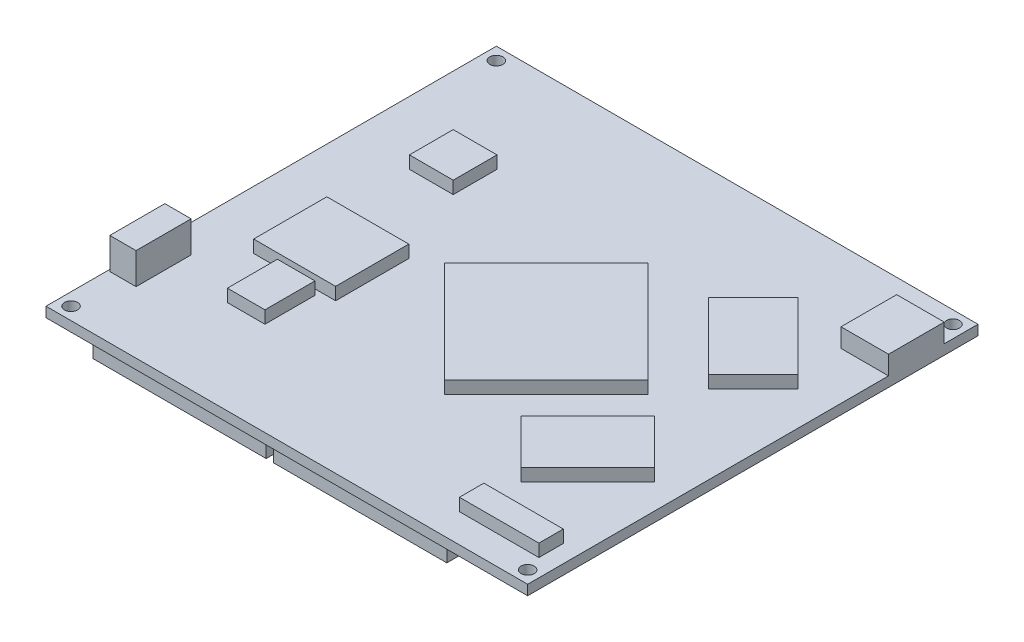
from build123d import *

# Parameters (mm, degrees)
SKETCH_1_W      = 77
SKETCH_1_H      = 72
SKETCH_1_R      = 1.05
EXTRUDE_1_DEPTH = 1.6
SKETCH_2_W      = 7
SKETCH_2_H      = 7
SKETCH_2_W_2    = 13.1
SKETCH_2_H_2    = 11.7
SKETCH_2_W_3    = 6
SKETCH_2_H_3    = 8
SKETCH_2_W_4    = 12.7
SKETCH_2_H_4    = 3.9
EXTRUDE_2_DEPTH = 2
SKETCH_3_W      = 7.6
SKETCH_3_H      = 8.9
EXTRUDE_3_DEPTH = 3
SKETCH_5_W      = 4.2
SKETCH_5_H      = 8.8
EXTRUDE_4_DEPTH = 5
SKETCH_6_W      = 27.7
SKETCH_6_H      = 3.9
EXTRUDE_5_DEPTH = 5


with BuildPart() as part:
    # 草图1 → 凸台-拉伸1 (new body)
    with BuildSketch(Plane(origin=(0, 0, 0), x_dir=(1, 0, 0), z_dir=(0, 1, 0))):
        with Locations((38.5, -36)):
            Rectangle(SKETCH_1_W, SKETCH_1_H)
        with Locations(Location((2, -2, 0), (0, 0, 270))):
            Circle(SKETCH_1_R, mode=Mode.SUBTRACT)
        with Locations(Location((2, -70, 0), (0, 0, 270))):
            Circle(SKETCH_1_R, mode=Mode.SUBTRACT)
        with Locations(Location((75, -2, 0), (0, 0, 270))):
            Circle(SKETCH_1_R, mode=Mode.SUBTRACT)
        with Locations(Location((75, -70, 0), (0, 0, 270))):
            Circle(SKETCH_1_R, mode=Mode.SUBTRACT)
    extrude(amount=EXTRUDE_1_DEPTH)

    # 草图2 → 凸台-拉伸2 (add)
    with BuildSketch(Plane(origin=(0, 1.6, 0), x_dir=(1, 0, 0), z_dir=(0, 1, 0))):
        with Locations((13.6, -20.5)):
            Rectangle(SKETCH_2_W, SKETCH_2_H)
        Polygon((44.1, -19.873088065), (27.836544033, -36.136544033), (44.1, -52.4), (60.363455967, -36.136544033), align=None)
        with Locations((15.85, -42.25)):
            Rectangle(SKETCH_2_W_2, SKETCH_2_H_2)
        with Locations((17, -53)):
            Rectangle(SKETCH_2_W_3, SKETCH_2_H_3)
        Polygon((65.835533906, -40.580909114), (55.15822151, -51.25822151), (62.3, -58.4), (72.977312396, -47.722687604), align=None)
        Polygon((60.864466094, -12.680909114), (53.722687604, -19.822687604), (64.4, -30.5), (71.54177849, -23.35822151), align=None)
        with Locations((67.85, -65.45)):
            Rectangle(SKETCH_2_W_4, SKETCH_2_H_4)
    extrude(amount=EXTRUDE_2_DEPTH)

    # 草图3 → 凸台-拉伸3 (add)
    with BuildSketch(Plane(origin=(0, 1.6, 0), x_dir=(1, 0, 0), z_dir=(0, 1, 0))):
        with Locations((73.2, -9.85)):
            Rectangle(SKETCH_3_W, SKETCH_3_H)
    extrude(amount=EXTRUDE_3_DEPTH)

    # 草图5 → 凸台-拉伸4 (add)
    with BuildSketch(Plane(origin=(0, 1.6, 0), x_dir=(1, 0, 0), z_dir=(0, 1, 0))):
        with Locations((2.4, -57.7)):
            Rectangle(SKETCH_5_W, SKETCH_5_H)
    extrude(amount=EXTRUDE_4_DEPTH)

    # 草图6 → 凸台-拉伸5 (add)
    with BuildSketch(Plane.XZ):
        with Locations((18.25, 66.95)):
            Rectangle(SKETCH_6_W, SKETCH_6_H)
        with Locations((47.13, 66.95)):
            Rectangle(SKETCH_6_W, SKETCH_6_H)
        with Locations((18.25, 5.05)):
            Rectangle(SKETCH_6_W, SKETCH_6_H)
        with Locations((47.13, 5.05)):
            Rectangle(SKETCH_6_W, SKETCH_6_H)
    extrude(amount=EXTRUDE_5_DEPTH)


solid = part.part
